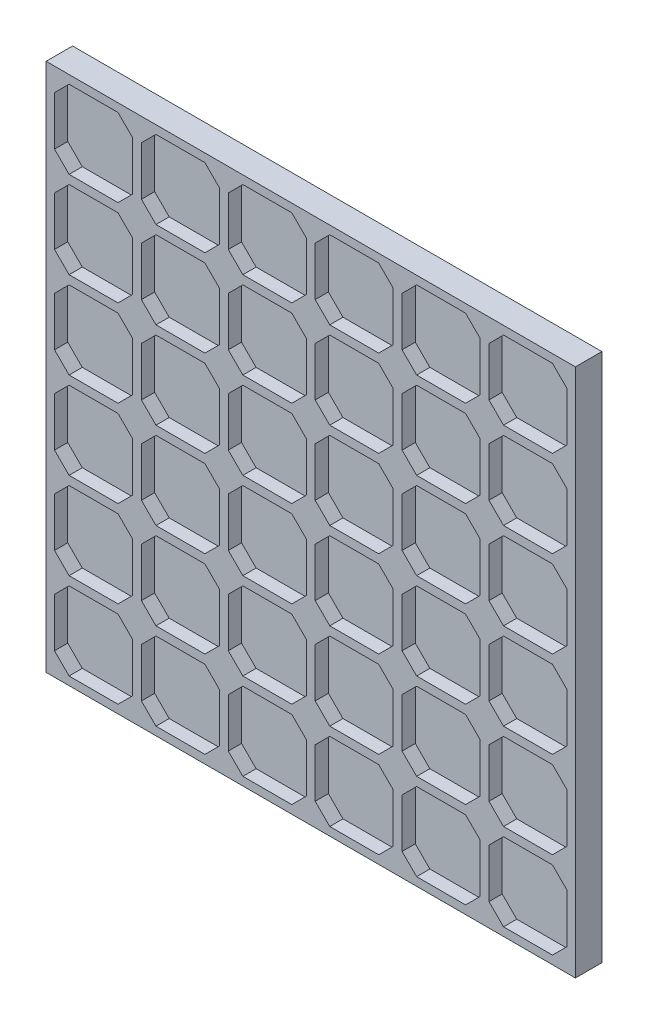
from build123d import *

# Parameters (mm, degrees)
SKIZZE1_W                       = 240
SKIZZE1_H                       = 240
AUFSATZ_LINEAR_AUSTRAGEN1_DEPTH = 6
SKIZZE2_W                       = 240
SKIZZE2_H                       = 240
SKIZZE2_W_2                     = 235
SKIZZE2_H_2                     = 235
AUFSATZ_LINEAR_AUSTRAGEN2_DEPTH = 6
SKIZZE3_W                       = 240
SKIZZE3_H                       = 240
AUFSATZ_LINEAR_AUSTRAGEN5_DEPTH = 6
SKIZZE4_W                       = 240
SKIZZE4_H                       = 240
SKIZZE4_W_2                     = 35.4
SKIZZE4_H_2                     = 35.4
AUFSATZ_LINEAR_AUSTRAGEN6_DEPTH = 6


with BuildPart() as part:
    # Skizze1 → Aufsatz-Linear austragen1 (new body)
    with BuildSketch(Plane.XY):
        with Locations((120, 120)):
            Rectangle(SKIZZE1_W, SKIZZE1_H)
    extrude(amount=AUFSATZ_LINEAR_AUSTRAGEN1_DEPTH)

    # Skizze2 → Aufsatz-Linear austragen2 (add)
    with BuildSketch(Plane.XY.offset(6)):
        with Locations((120, 120)):
            Rectangle(SKIZZE2_W, SKIZZE2_H)
        with Locations((120, 120)):
            Rectangle(SKIZZE2_W_2, SKIZZE2_H_2, mode=Mode.SUBTRACT)
    extrude(amount=AUFSATZ_LINEAR_AUSTRAGEN2_DEPTH)

    # Skizze3 → Aufsatz-Linear austragen5 (add)
    # profile 1 of 26: a face of its own
    with BuildSketch(Plane.XY.offset(6)):
        with Locations((120, 120)):
            Rectangle(SKIZZE3_W, SKIZZE3_H)
        Polygon((1.8, 188.193398282), (12.406601718, 198.8), (1.8, 209.406601718), (1.8, 227.593398282), (12.406601718, 238.2), (30.593398282, 238.2), (41.2, 227.593398282), (51.806601718, 238.2), (69.993398282, 238.2), (80.6, 227.593398282), (91.206601718, 238.2), (109.393398282, 238.2), (120, 227.593398282), (130.606601718, 238.2), (148.793398282, 238.2), (159.4, 227.593398282), (170.006601718, 238.2), (188.193398282, 238.2), (198.8, 227.593398282), (209.406601718, 238.2), (227.593398282, 238.2), (238.2, 227.593398282), (238.2, 209.406601718), (227.593398282, 198.8), (238.2, 188.193398282), (238.2, 170.006601718), (227.593398282, 159.4), (238.2, 148.793398282), (238.2, 130.606601718), (227.593398282, 120), (238.2, 109.393398282), (238.2, 91.206601718), (227.593398282, 80.6), (238.2, 69.993398282), (238.2, 51.806601718), (227.593398282, 41.2), (238.2, 30.593398282), (238.2, 12.406601718), (227.593398282, 1.8), (209.406601718, 1.8), (198.8, 12.406601718), (188.193398282, 1.8), (170.006601718, 1.8), (159.4, 12.406601718), (148.793398282, 1.8), (130.606601718, 1.8), (120, 12.406601718), (109.393398282, 1.8), (91.206601718, 1.8), (80.6, 12.406601718), (69.993398282, 1.8), (51.806601718, 1.8), (41.2, 12.406601718), (30.593398282, 1.8), (12.406601718, 1.8), (1.8, 12.406601718), (1.8, 30.593398282), (12.406601718, 41.2), (1.8, 51.806601718), (1.8, 69.993398282), (12.406601718, 80.6), (1.8, 91.206601718), (1.8, 109.393398282), (12.406601718, 120), (1.8, 130.606601718), (1.8, 148.793398282), (12.406601718, 159.4), (1.8, 170.006601718), align=None, mode=Mode.SUBTRACT)
    # profile 2 of 26: a face of its own
    with BuildSketch(Plane.XY.offset(6)):
        Polygon((41.2, 209.406601718), (30.593398282, 198.8), (41.2, 188.193398282), (51.806601718, 198.8), align=None)
    # profile 3 of 26: a face of its own
    with BuildSketch(Plane.XY.offset(6)):
        Polygon((80.6, 209.406601718), (69.993398282, 198.8), (80.6, 188.193398282), (91.206601718, 198.8), align=None)
    # profile 4 of 26: a face of its own
    with BuildSketch(Plane.XY.offset(6)):
        Polygon((159.4, 188.193398282), (170.006601718, 198.8), (159.4, 209.406601718), (148.793398282, 198.8), align=None)
    # profile 5 of 26: a face of its own
    with BuildSketch(Plane.XY.offset(6)):
        Polygon((120, 188.193398282), (130.606601718, 198.8), (120, 209.406601718), (109.393398282, 198.8), align=None)
    # profile 6 of 26: a face of its own
    with BuildSketch(Plane.XY.offset(6)):
        Polygon((198.8, 209.406601718), (188.193398282, 198.8), (198.8, 188.193398282), (209.406601718, 198.8), align=None)
    # profile 7 of 26: a face of its own
    with BuildSketch(Plane.XY.offset(6)):
        Polygon((198.8, 130.606601718), (188.193398282, 120), (198.8, 109.393398282), (209.406601718, 120), align=None)
    # profile 8 of 26: a face of its own
    with BuildSketch(Plane.XY.offset(6)):
        Polygon((170.006601718, 120), (159.4, 130.606601718), (148.793398282, 120), (159.4, 109.393398282), align=None)
    # profile 9 of 26: a face of its own
    with BuildSketch(Plane.XY.offset(6)):
        Polygon((130.606601718, 120), (120, 130.606601718), (109.393398282, 120), (120, 109.393398282), align=None)
    # profile 10 of 26: a face of its own
    with BuildSketch(Plane.XY.offset(6)):
        Polygon((80.6, 130.606601718), (69.993398282, 120), (80.6, 109.393398282), (91.206601718, 120), align=None)
    # profile 11 of 26: a face of its own
    with BuildSketch(Plane.XY.offset(6)):
        Polygon((30.593398282, 120), (41.2, 109.393398282), (51.806601718, 120), (41.2, 130.606601718), align=None)
    # profile 12 of 26: a face of its own
    with BuildSketch(Plane.XY.offset(6)):
        Polygon((198.8, 51.806601718), (188.193398282, 41.2), (198.8, 30.593398282), (209.406601718, 41.2), align=None)
    # profile 13 of 26: a face of its own
    with BuildSketch(Plane.XY.offset(6)):
        Polygon((159.4, 30.593398282), (170.006601718, 41.2), (159.4, 51.806601718), (148.793398282, 41.2), align=None)
    # profile 14 of 26: a face of its own
    with BuildSketch(Plane.XY.offset(6)):
        Polygon((130.606601718, 41.2), (120, 51.806601718), (109.393398282, 41.2), (120, 30.593398282), align=None)
    # profile 15 of 26: a face of its own
    with BuildSketch(Plane.XY.offset(6)):
        Polygon((41.2, 51.806601718), (30.593398282, 41.2), (41.2, 30.593398282), (51.806601718, 41.2), align=None)
    # profile 16 of 26: a face of its own
    with BuildSketch(Plane.XY.offset(6)):
        Polygon((91.206601718, 41.2), (80.6, 51.806601718), (69.993398282, 41.2), (80.6, 30.593398282), align=None)
    # profile 17 of 26: a face of its own
    with BuildSketch(Plane.XY.offset(6)):
        Polygon((41.2, 170.006601718), (30.593398282, 159.4), (41.2, 148.793398282), (51.806601718, 159.4), align=None)
    # profile 18 of 26: a face of its own
    with BuildSketch(Plane.XY.offset(6)):
        Polygon((80.6, 170.006601718), (69.993398282, 159.4), (80.6, 148.793398282), (91.206601718, 159.4), align=None)
    # profile 19 of 26: a face of its own
    with BuildSketch(Plane.XY.offset(6)):
        Polygon((159.4, 148.793398282), (170.006601718, 159.4), (159.4, 170.006601718), (148.793398282, 159.4), align=None)
    # profile 20 of 26: a face of its own
    with BuildSketch(Plane.XY.offset(6)):
        Polygon((198.8, 148.793398282), (209.406601718, 159.4), (198.8, 170.006601718), (188.193398282, 159.4), align=None)
    # profile 21 of 26: a face of its own
    with BuildSketch(Plane.XY.offset(6)):
        Polygon((109.393398282, 159.4), (120, 148.793398282), (130.606601718, 159.4), (120, 170.006601718), align=None)
    # profile 22 of 26: a face of its own
    with BuildSketch(Plane.XY.offset(6)):
        Polygon((209.406601718, 80.6), (198.8, 91.206601718), (188.193398282, 80.6), (198.8, 69.993398282), align=None)
    # profile 23 of 26: a face of its own
    with BuildSketch(Plane.XY.offset(6)):
        Polygon((170.006601718, 80.6), (159.4, 91.206601718), (148.793398282, 80.6), (159.4, 69.993398282), align=None)
    # profile 24 of 26: a face of its own
    with BuildSketch(Plane.XY.offset(6)):
        Polygon((120, 91.206601718), (109.393398282, 80.6), (120, 69.993398282), (130.606601718, 80.6), align=None)
    # profile 25 of 26: a face of its own
    with BuildSketch(Plane.XY.offset(6)):
        Polygon((69.993398282, 80.6), (80.6, 69.993398282), (91.206601718, 80.6), (80.6, 91.206601718), align=None)
    # profile 26 of 26: a face of its own
    with BuildSketch(Plane.XY.offset(6)):
        Polygon((30.593398282, 80.6), (41.2, 69.993398282), (51.806601718, 80.6), (41.2, 91.206601718), align=None)
    extrude(amount=AUFSATZ_LINEAR_AUSTRAGEN5_DEPTH)

    # Skizze4 → Aufsatz-Linear austragen6 (add)
    with BuildSketch(Plane.XY.offset(6)):
        with Locations((120, 120)):
            Rectangle(SKIZZE4_W, SKIZZE4_H)
        with Locations((21.5, 21.5)):
            Rectangle(SKIZZE4_W_2, SKIZZE4_H_2, mode=Mode.SUBTRACT)
        with Locations((60.9, 21.5)):
            Rectangle(SKIZZE4_W_2, SKIZZE4_H_2, mode=Mode.SUBTRACT)
        with Locations((100.3, 21.5)):
            Rectangle(SKIZZE4_W_2, SKIZZE4_H_2, mode=Mode.SUBTRACT)
        with Locations((139.7, 21.5)):
            Rectangle(SKIZZE4_W_2, SKIZZE4_H_2, mode=Mode.SUBTRACT)
        with Locations((179.1, 21.5)):
            Rectangle(SKIZZE4_W_2, SKIZZE4_H_2, mode=Mode.SUBTRACT)
        with Locations((218.5, 21.5)):
            Rectangle(SKIZZE4_W_2, SKIZZE4_H_2, mode=Mode.SUBTRACT)
        with Locations((21.5, 218.5)):
            Rectangle(SKIZZE4_W_2, SKIZZE4_H_2, mode=Mode.SUBTRACT)
        with Locations((21.5, 179.1)):
            Rectangle(SKIZZE4_W_2, SKIZZE4_H_2, mode=Mode.SUBTRACT)
        with Locations((21.5, 139.7)):
            Rectangle(SKIZZE4_W_2, SKIZZE4_H_2, mode=Mode.SUBTRACT)
        with Locations((21.5, 100.3)):
            Rectangle(SKIZZE4_W_2, SKIZZE4_H_2, mode=Mode.SUBTRACT)
        with Locations((21.5, 60.9)):
            Rectangle(SKIZZE4_W_2, SKIZZE4_H_2, mode=Mode.SUBTRACT)
        with Locations((60.9, 218.5)):
            Rectangle(SKIZZE4_W_2, SKIZZE4_H_2, mode=Mode.SUBTRACT)
        with Locations((60.9, 179.1)):
            Rectangle(SKIZZE4_W_2, SKIZZE4_H_2, mode=Mode.SUBTRACT)
        with Locations((100.3, 218.5)):
            Rectangle(SKIZZE4_W_2, SKIZZE4_H_2, mode=Mode.SUBTRACT)
        with Locations((100.3, 179.1)):
            Rectangle(SKIZZE4_W_2, SKIZZE4_H_2, mode=Mode.SUBTRACT)
        with Locations((139.7, 218.5)):
            Rectangle(SKIZZE4_W_2, SKIZZE4_H_2, mode=Mode.SUBTRACT)
        with Locations((139.7, 179.1)):
            Rectangle(SKIZZE4_W_2, SKIZZE4_H_2, mode=Mode.SUBTRACT)
        with Locations((179.1, 218.5)):
            Rectangle(SKIZZE4_W_2, SKIZZE4_H_2, mode=Mode.SUBTRACT)
        with Locations((179.1, 179.1)):
            Rectangle(SKIZZE4_W_2, SKIZZE4_H_2, mode=Mode.SUBTRACT)
        with Locations((218.5, 218.5)):
            Rectangle(SKIZZE4_W_2, SKIZZE4_H_2, mode=Mode.SUBTRACT)
        with Locations((218.5, 179.1)):
            Rectangle(SKIZZE4_W_2, SKIZZE4_H_2, mode=Mode.SUBTRACT)
        with Locations((218.5, 139.7)):
            Rectangle(SKIZZE4_W_2, SKIZZE4_H_2, mode=Mode.SUBTRACT)
        with Locations((179.1, 139.7)):
            Rectangle(SKIZZE4_W_2, SKIZZE4_H_2, mode=Mode.SUBTRACT)
        with Locations((139.7, 139.7)):
            Rectangle(SKIZZE4_W_2, SKIZZE4_H_2, mode=Mode.SUBTRACT)
        with Locations((100.3, 139.7)):
            Rectangle(SKIZZE4_W_2, SKIZZE4_H_2, mode=Mode.SUBTRACT)
        with Locations((60.9, 139.7)):
            Rectangle(SKIZZE4_W_2, SKIZZE4_H_2, mode=Mode.SUBTRACT)
        with Locations((60.9, 100.3)):
            Rectangle(SKIZZE4_W_2, SKIZZE4_H_2, mode=Mode.SUBTRACT)
        with Locations((100.3, 100.3)):
            Rectangle(SKIZZE4_W_2, SKIZZE4_H_2, mode=Mode.SUBTRACT)
        with Locations((139.7, 100.3)):
            Rectangle(SKIZZE4_W_2, SKIZZE4_H_2, mode=Mode.SUBTRACT)
        with Locations((179.1, 100.3)):
            Rectangle(SKIZZE4_W_2, SKIZZE4_H_2, mode=Mode.SUBTRACT)
        with Locations((218.5, 100.3)):
            Rectangle(SKIZZE4_W_2, SKIZZE4_H_2, mode=Mode.SUBTRACT)
        with Locations((218.5, 60.9)):
            Rectangle(SKIZZE4_W_2, SKIZZE4_H_2, mode=Mode.SUBTRACT)
        with Locations((179.1, 60.9)):
            Rectangle(SKIZZE4_W_2, SKIZZE4_H_2, mode=Mode.SUBTRACT)
        with Locations((139.7, 60.9)):
            Rectangle(SKIZZE4_W_2, SKIZZE4_H_2, mode=Mode.SUBTRACT)
        with Locations((100.3, 60.9)):
            Rectangle(SKIZZE4_W_2, SKIZZE4_H_2, mode=Mode.SUBTRACT)
        with Locations((60.9, 60.9)):
            Rectangle(SKIZZE4_W_2, SKIZZE4_H_2, mode=Mode.SUBTRACT)
    extrude(amount=AUFSATZ_LINEAR_AUSTRAGEN6_DEPTH)


solid = part.part
